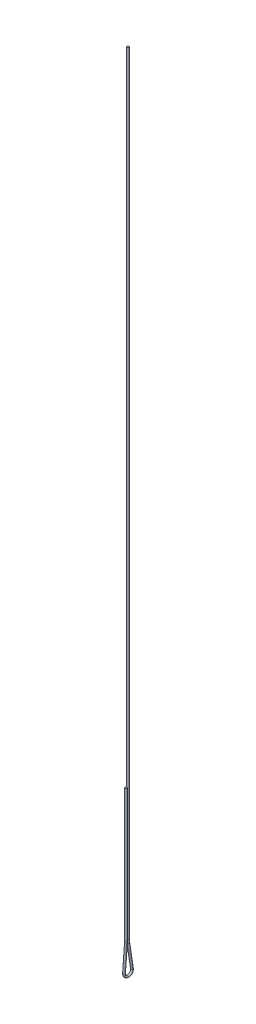
from build123d import *

# Parameters (mm, degrees)
SKETCH2_R = 0.75


with BuildPart() as part:
    # Sweep1: sweep along a path in Sketch1
    with BuildLine(Plane(origin=(0, 0, 0), x_dir=(0, 0, -1), z_dir=(1, 0, 0))) as sweep1_path:
        Line((0, 600), (0, 21.508533778))
        ThreePointArc((0, 21.508533778), (0.056650248, 20.004272941), (0.226280067, 18.508533778))
        Line((0.226280067, 18.508533778), (2.96605799, 0.45))
        ThreePointArc((2.96605799, 0.45), (0.112900451, -2.997874829), (-2.9915026, 0.225637305))
        Line((-2.9915026, 0.225637305), (-1.556649332, 19.248942344))
        ThreePointArc((-1.556649332, 19.248942344), (-1.514167351, 20.000533536), (-1.5, 20.753191044))
        Line((-1.5, 20.753191044), (-1.5, 120))
    # Sketch2 → Sweep1 (sweep)
    with BuildSketch(Plane(origin=(0, 120, 1.5), x_dir=(-1, 0, 0), z_dir=(0, 1, 0))):
        Circle(SKETCH2_R)
    sweep(path=sweep1_path.line)


solid = part.part
